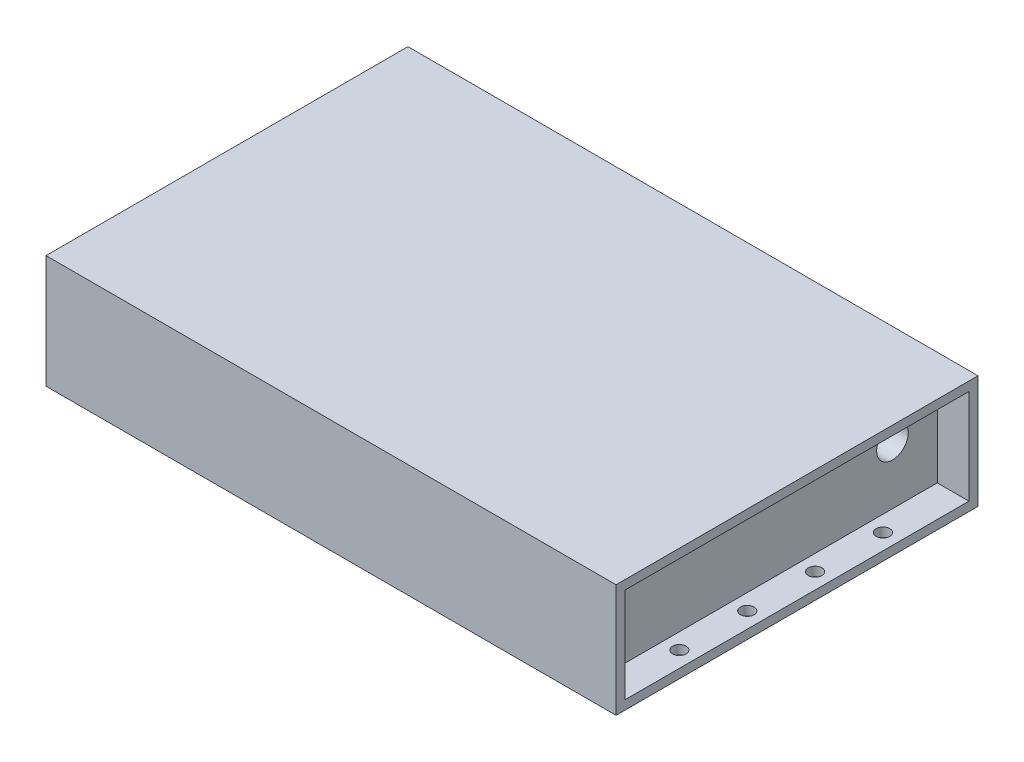
from build123d import *

# Parameters (mm, degrees)
SKETCH_1_W          = 126
SKETCH_1_H          = 80
EXTRUDE_1_DEPTH     = 25
SKETCH_2_W          = 76
SKETCH_2_H          = 21
CUT_EXTRUDE_1_DEPTH = 7
SKETCH_3_W          = 76
SKETCH_3_H          = 21
CUT_EXTRUDE_2_DEPTH = 7
SKETCH_4_R          = 3.5
CUT_EXTRUDE_3_DEPTH = 7
SKETCH_5_R          = 1.5
CUT_EXTRUDE_5_DEPTH = 23
SKETCH_6_R          = 1.5
CUT_EXTRUDE_6_DEPTH = 23


with BuildPart() as part:
    # 草图1 → 凸台-拉伸1 (new body)
    with BuildSketch(Plane(origin=(0, 0, 0), x_dir=(1, 0, 0), z_dir=(0, 1, 0))):
        with Locations((63, -40)):
            Rectangle(SKETCH_1_W, SKETCH_1_H)
    extrude(amount=EXTRUDE_1_DEPTH)

    # 草图2 → 切除-拉伸1 (cut)
    with BuildSketch(Plane(origin=(126, 0, 0), x_dir=(0, 0, -1), z_dir=(1, 0, 0))):
        with Locations((-40, 12.5)):
            Rectangle(SKETCH_2_W, SKETCH_2_H)
    extrude(amount=-CUT_EXTRUDE_1_DEPTH, mode=Mode.SUBTRACT)

    # 草图3 → 切除-拉伸2 (cut)
    with BuildSketch(Plane.ZY):
        with Locations((40, 12.5)):
            Rectangle(SKETCH_3_W, SKETCH_3_H)
    extrude(amount=-CUT_EXTRUDE_2_DEPTH, mode=Mode.SUBTRACT)

    # 草图4 → 切除-拉伸3 (cut)
    with BuildSketch(Plane(origin=(119, 0, 0), x_dir=(0, 0, -1), z_dir=(1, 0, 0))):
        with Locations((-11.90518779, 14.841361907)):
            Circle(SKETCH_4_R)
    extrude(amount=-CUT_EXTRUDE_3_DEPTH, mode=Mode.SUBTRACT)

    # 草图5 → 切除-拉伸5 (cut)
    with BuildSketch(Plane(origin=(0, 2, 0), x_dir=(1, 0, 0), z_dir=(0, 1, 0))):
        with Locations(Location((122.5, -17.5, 0), (0, 0, 270))):
            Circle(SKETCH_5_R)
        with Locations(Location((122.5, -32.5, 0), (0, 0, 270))):
            Circle(SKETCH_5_R)
        with Locations(Location((122.5, -47.5, 0), (0, 0, 270))):
            Circle(SKETCH_5_R)
        with Locations(Location((122.5, -62.5, 0), (0, 0, 270))):
            Circle(SKETCH_5_R)
    extrude(amount=-CUT_EXTRUDE_5_DEPTH, mode=Mode.SUBTRACT)

    # 草图6 → 切除-拉伸6 (cut)
    with BuildSketch(Plane(origin=(0, 2, 0), x_dir=(1, 0, 0), z_dir=(0, 1, 0))):
        with Locations(Location((3.5, -17.5, 0), (0, 0, 270))):
            Circle(SKETCH_6_R)
        with Locations(Location((3.5, -32.5, 0), (0, 0, 270))):
            Circle(SKETCH_6_R)
        with Locations(Location((3.5, -47.5, 0), (0, 0, 270))):
            Circle(SKETCH_6_R)
        with Locations(Location((3.5, -62.5, 0), (0, 0, 270))):
            Circle(SKETCH_6_R)
    extrude(amount=-CUT_EXTRUDE_6_DEPTH, mode=Mode.SUBTRACT)


solid = part.part
